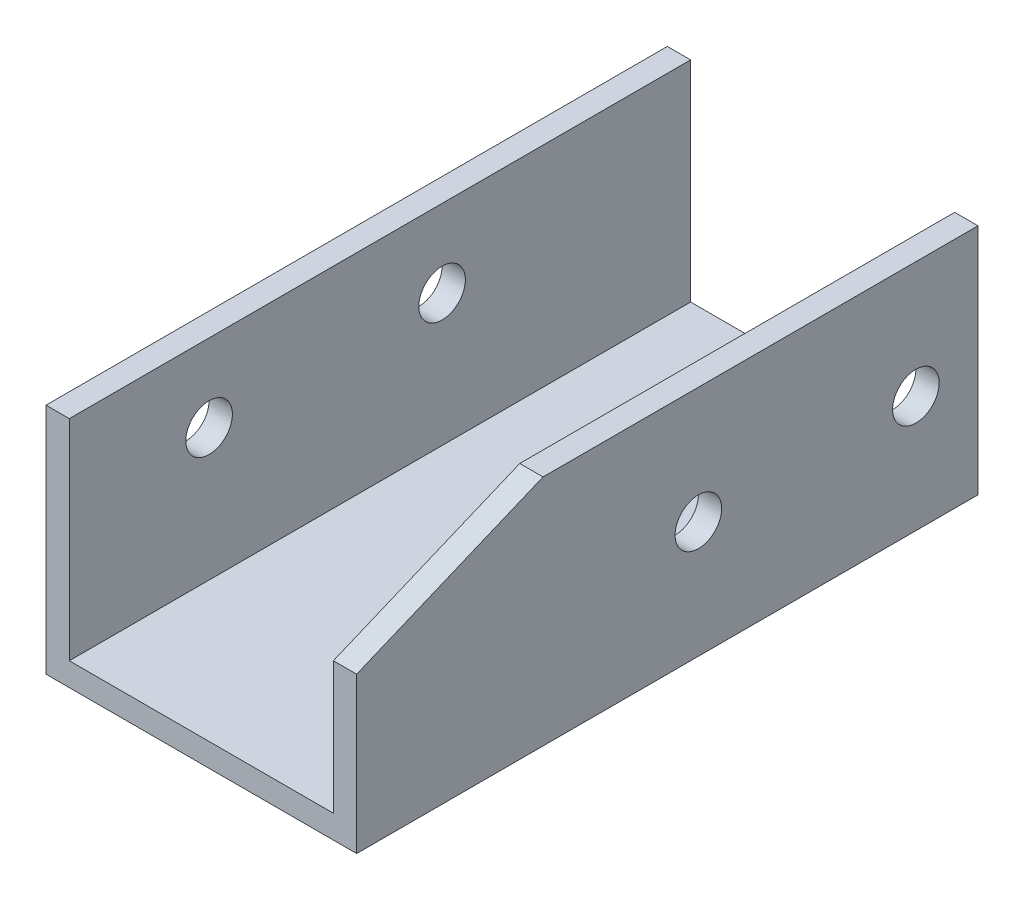
from build123d import *

# Parameters (mm, degrees)
EXTRUSION1_DEPTH = 40
ESQUISSE2_R      = 1.5
EXTRUSION2_DEPTH = 10
ESQUISSE6_R      = 1.5
EXTRUSION6_DEPTH = 10


with BuildPart() as part:
    # Esquisse1 → Extrusion1 (new body)
    with BuildSketch(Plane.XY):
        Polygon((-17.090791643, 12.954), (-17.090791643, -2.046), (2.909208357, -2.046), (2.909208357, 12.954), (1.409208357, 12.954), (1.409208357, -0.546), (-15.590791643, -0.546), (-15.590791643, 12.954), align=None)
    extrude(amount=EXTRUSION1_DEPTH)

    # Esquisse2 → Extrusion2 (cut)
    with BuildSketch(Plane(origin=(2.909208357, 0, 0), x_dir=(0, 0, -1), z_dir=(1, 0, 0))):
        with Locations((-18, 5.454)):
            Circle(ESQUISSE2_R)
        with Locations((-4, 5.454)):
            Circle(ESQUISSE2_R)
        Polygon((-40, 12.954), (-28, 12.954), (-40, 7.954), align=None)
    extrude(amount=-EXTRUSION2_DEPTH, mode=Mode.SUBTRACT)

    # Esquisse6 → Extrusion6 (cut)
    with BuildSketch(Plane.ZY.offset(17.090791643)):
        with Locations(Location((31, 7.954, 0), (0, 0, 270))):
            Circle(ESQUISSE6_R)
        with Locations(Location((16, 7.954, 0), (0, 0, 270))):
            Circle(ESQUISSE6_R)
    extrude(amount=-EXTRUSION6_DEPTH, mode=Mode.SUBTRACT)


solid = part.part
